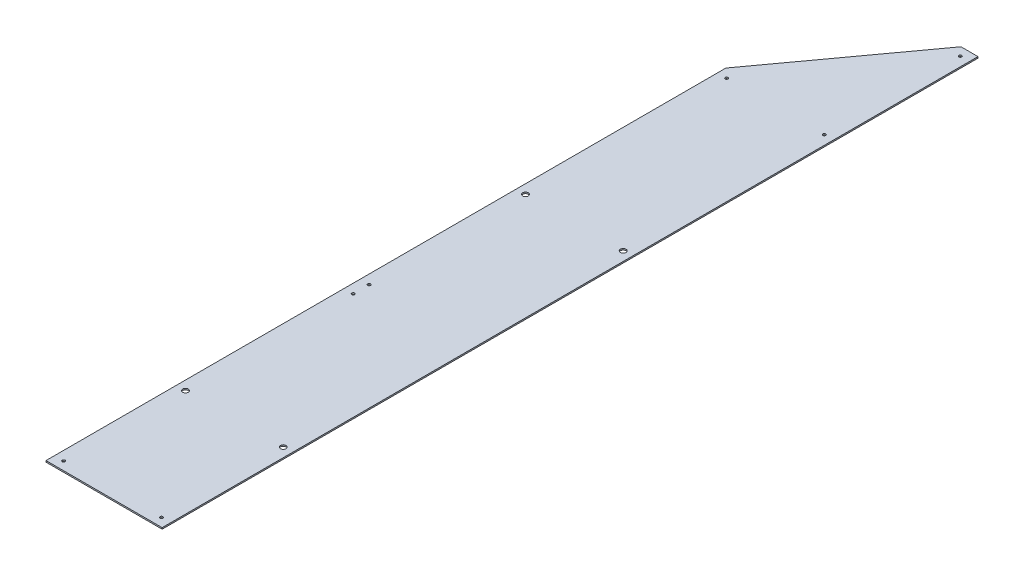
from build123d import *

# Parameters (mm, degrees)
SKETCH1_W                     = 130.175
SKETCH1_H                     = 914.4
BOSS_EXTRUDE1_DEPTH           = 1.5875
SKETCH2_R                     = 1.5875
SKETCH2_R_2                   = 3.175
CUT_EXTRUDE2_DEPTH            = 462.812454155
SKETCH3_R                     = 1.5875
CUT_EXTRUDE3_DEPTH            = 462.812454155
STRUTMOUNTINGHOLES_DEPTH      = 462.812454155
STRUTMOUNTINGHOLES_DEPTH_BACK = 462.812454155
SKETCH5_R                     = 1.5875


with BuildPart() as part:
    # Sketch1 → Boss-Extrude1 (new body)
    with BuildSketch(Plane(origin=(0, 0, 0), x_dir=(1, 0, 0), z_dir=(0, 1, 0))):
        Rectangle(SKETCH1_W, SKETCH1_H)
    extrude(amount=-BOSS_EXTRUDE1_DEPTH)

    # Sketch2 → Cut-Extrude2 (cut, through all)
    with BuildSketch(Plane(origin=(0, 0, 0), x_dir=(1, 0, 0), z_dir=(0, 1, 0))):
        with Locations(Location((54.76875, -447.675, 0), (0, 0, 270))):
            Circle(SKETCH2_R)
        with Locations(Location((54.76875, -311.15, 0), (0, 0, 270))):
            Circle(SKETCH2_R_2)
        with Locations(Location((54.76875, 447.675, 0), (0, 0, 270))):
            Circle(SKETCH2_R)
        with Locations(Location((54.76875, 69.85, 0), (0, 0, 270))):
            Circle(SKETCH2_R_2)
        with Locations(Location((54.76875, 295.275, 0), (0, 0, 270))):
            Circle(SKETCH2_R)
    cut_extrude2 = extrude(amount=-CUT_EXTRUDE2_DEPTH, mode=Mode.SUBTRACT)

    # Mirror2: Cut-Extrude2 across plane
    add(cut_extrude2.mirror(Plane.ZY), mode=Mode.SUBTRACT)

    # Sketch3 → Cut-Extrude3 (cut, through all)
    with BuildSketch(Plane.XZ.offset(1.5875)):
        Polygon((-65.0875, -457.2), (46.0375, -457.2), (-65.0875, -304.8), align=None)
        with Locations((-54.76875, -447.675)):
            Circle(SKETCH3_R, mode=Mode.SUBTRACT)
    extrude(amount=-CUT_EXTRUDE3_DEPTH, mode=Mode.SUBTRACT)

    # Sketch5 → StrutMountingHoles (cut, two sides: drawn at the far end of the back side and taken through both)
    with BuildSketch(Plane(origin=(0, -1.5875, 0), x_dir=(-1, 0, 0), z_dir=(0, -1, 0)).offset(-STRUTMOUNTINGHOLES_DEPTH_BACK)):
        with Locations(Location((54.76875, -123.19, 0), (0, 0, 90))):
            Circle(SKETCH5_R)
        with Locations(Location((54.76875, -105.41, 0), (0, 0, 90))):
            Circle(SKETCH5_R)
    extrude(amount=STRUTMOUNTINGHOLES_DEPTH + STRUTMOUNTINGHOLES_DEPTH_BACK, mode=Mode.SUBTRACT)


solid = part.part
